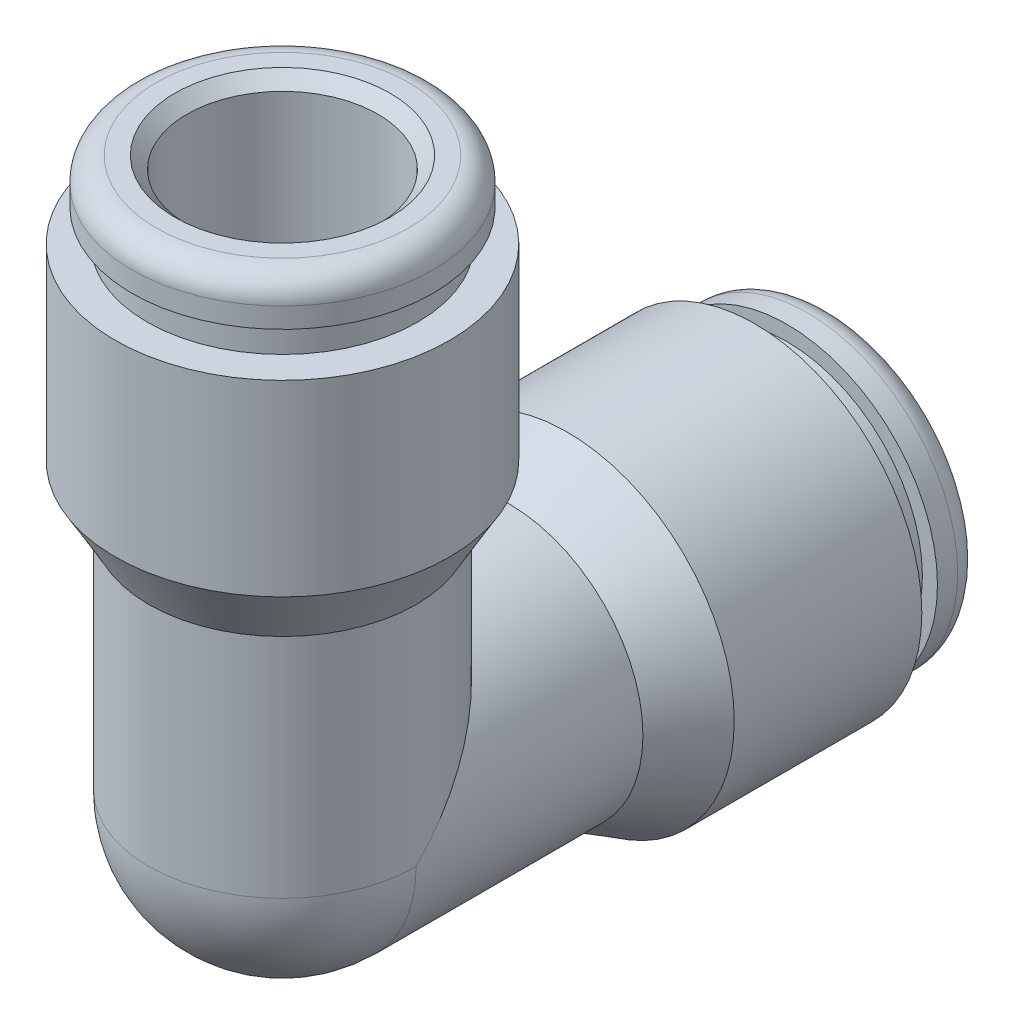
from build123d import *

# Parameters (mm, degrees)
CIRPATTERN1_COUNT = 2
CIRPATTERN1_ANGLE = 90
REVOLVE2_ANGLE    = 90
CIRPATTERN2_COUNT = 2
CIRPATTERN2_ANGLE = 90


with BuildPart() as part:
    # Sketch1 → Revolve1 (revolve)
    with BuildSketch(Plane(origin=(0, 0, 0), x_dir=(0, 0, -1), z_dir=(1, 0, 0)), mode=Mode.PRIVATE) as revolve1_sk:
        with BuildLine():
            Line((15.853, 4.725), (16.488, 4.725))
            ThreePointArc((16.488, 4.725), (17.026815367, 4.501815367), (17.25, 3.963))
            Line((17.25, 3.963), (17.25, 3.381))
            Line((17.25, 3.381), (16.869, 3))
            Line((16.869, 3), (6, 3))
            Line((6, 3), (6, 2.238))
            Line((6, 2.238), (0, 2.238))
            Line((0, 2.238), (0, 4.2))
            Line((0, 4.2), (7.125, 4.2))
            Line((7.125, 4.2), (8.943653348, 5.25))
            Line((8.943653348, 5.25), (14.837, 5.25))
            Line((14.837, 5.25), (14.837, 4.2525))
            Line((14.837, 4.2525), (15.853, 4.2525))
            Line((15.853, 4.2525), (15.853, 4.725))
        make_face()
    revolve(revolve1_sk.sketch.rotate(Axis((0, 0, 0), (0, 0, -1)), 90), axis=Axis((0, 0, 0), (0, 0, -1)))


with BuildPart() as cirpattern1_1:
    # CirPattern1: pattern copy
    add(part.part.rotate(Axis((-5.775, 0, 0), (1, 0, 0)), 1 * CIRPATTERN1_ANGLE / (CIRPATTERN1_COUNT - 1)))


with BuildPart() as part_1:
    add(part.part)

    # Sketch2 → Revolve2 (revolve)
    with BuildSketch(Plane.XY):
        with BuildLine():
            Line((-4.2, 0), (-2.238, 0))
            ThreePointArc((-2.238, 0), (0, -2.238), (2.238, 0))
            Line((2.238, 0), (4.2, 0))
            ThreePointArc((4.2, 0), (0, -4.2), (-4.2, 0))
        make_face()
    revolve(axis=Axis((-4.2, 0, 0), (-1, 0, 0)), revolution_arc=REVOLVE2_ANGLE)

    # Combine1: union CirPattern1_1
    add(cirpattern1_1.part)

    # Sketch3 → Cut-Revolve1 (revolve, cut)
    with BuildSketch(Plane(origin=(0, 0, 0), x_dir=(0, 0, -1), z_dir=(1, 0, 0)), mode=Mode.PRIVATE) as cut_revolve1_sk:
        Polygon((17.25, 3.381), (16.869, 3), (6, 3), (6, 2.238), (0, 2.238), (0, 0), (17.25, 0), align=None)
    cut_revolve1 = revolve(cut_revolve1_sk.sketch.rotate(Axis((0, 0, 0), (0, 0, -1)), 90), axis=Axis((0, 0, 0), (0, 0, -1)), mode=Mode.SUBTRACT)

    # CirPattern2: Cut-Revolve1 ×2 about axis
    cirpattern2_axis = Axis((-5.775, 0, 0), (1, 0, 0))
    for i in range(1, CIRPATTERN2_COUNT):
        add(cut_revolve1.rotate(cirpattern2_axis, i * CIRPATTERN2_ANGLE / (CIRPATTERN2_COUNT - 1)), mode=Mode.SUBTRACT)


solid = part_1.part
